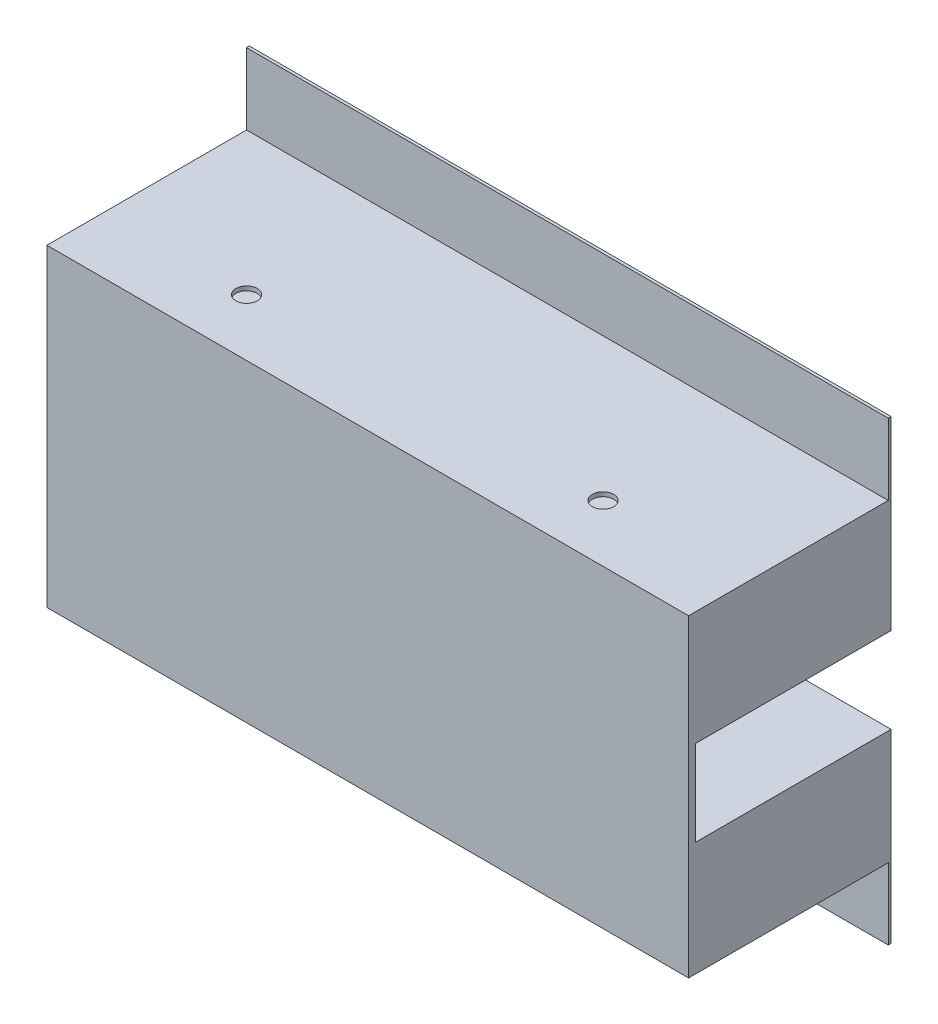
from build123d import *

# Parameters (mm, degrees)
SKETCH_1_W          = 450
SKETCH_1_H          = 220
EXTRUDE_1_DEPTH     = 140
SKETCH_2_W          = 450
SKETCH_2_H          = 320
EXTRUDE_2_DEPTH     = 2
SKETCH_3_W          = 444
SKETCH_3_H          = 214
CUT_EXTRUDE_1_DEPTH = 139
SKETCH_4_W          = 444
SKETCH_4_H          = 4
EXTRUDE_3_DEPTH     = 139
SKETCH_5_W          = 60
SKETCH_5_H          = 4
EXTRUDE_4_DEPTH     = 30
SKETCH_6_W          = 137
SKETCH_6_H          = 60
CUT_EXTRUDE_2_DEPTH = 10
SKETCH_7_R          = 7.5
CUT_EXTRUDE_3_DEPTH = 70
SKETCH_8_W          = 2
SKETCH_8_H          = 60
EXTRUDE_5_DEPTH     = 139
SKETCH_9_W          = 30
SKETCH_9_H          = 60
CUT_EXTRUDE_4_DEPTH = 240
SKETCH_10_R         = 7.5
CUT_EXTRUDE_5_DEPTH = 220
SKETCH_11_R         = 7.5
CUT_EXTRUDE_6_DEPTH = 220


with BuildPart() as part:
    # 草图1 → 凸台-拉伸1 (new body)
    with BuildSketch(Plane.XY):
        Rectangle(SKETCH_1_W, SKETCH_1_H)
    extrude(amount=EXTRUDE_1_DEPTH)

    # 草图2 → 凸台-拉伸2 (add)
    with BuildSketch(Plane(origin=(0, 0, 0), x_dir=(-1, 0, 0), z_dir=(0, 0, -1))):
        Rectangle(SKETCH_2_W, SKETCH_2_H)
    extrude(amount=EXTRUDE_2_DEPTH)

    # 草图3 → 切除-拉伸1 (cut)
    with BuildSketch(Plane(origin=(0, 0, -2), x_dir=(-1, 0, 0), z_dir=(0, 0, -1))):
        Rectangle(SKETCH_3_W, SKETCH_3_H)
    extrude(amount=-CUT_EXTRUDE_1_DEPTH, mode=Mode.SUBTRACT)

    # 草图4 → 凸台-拉伸3 (add)
    with BuildSketch(Plane(origin=(0, 0, 137), x_dir=(-1, 0, 0), z_dir=(0, 0, -1))):
        with Locations((0, -32)):
            Rectangle(SKETCH_4_W, SKETCH_4_H)
        with Locations((0, 32)):
            Rectangle(SKETCH_4_W, SKETCH_4_H)
    extrude(amount=EXTRUDE_3_DEPTH)

    # 草图5 → 凸台-拉伸4 (add)
    with BuildSketch(Plane(origin=(0, 0, -2), x_dir=(-1, 0, 0), z_dir=(0, 0, -1))):
        with Locations((-125, 32)):
            Rectangle(SKETCH_5_W, SKETCH_5_H)
        with Locations((-125, -32)):
            Rectangle(SKETCH_5_W, SKETCH_5_H)
    extrude(amount=EXTRUDE_4_DEPTH)

    # 草图6 → 切除-拉伸2 (cut)
    with BuildSketch(Plane(origin=(225, 0, 0), x_dir=(0, 0, -1), z_dir=(1, 0, 0))):
        with Locations((-66.5, 0)):
            Rectangle(SKETCH_6_W, SKETCH_6_H)
    extrude(amount=-CUT_EXTRUDE_2_DEPTH, mode=Mode.SUBTRACT)

    # 草图7 → 切除-拉伸3 (cut)
    with BuildSketch(Plane.XZ.offset(34)):
        with Locations(Location((125, -2, 0), (0, 0, 270))):
            Circle(SKETCH_7_R)
    extrude(amount=-CUT_EXTRUDE_3_DEPTH, mode=Mode.SUBTRACT)

    # 草图8 → 凸台-拉伸5 (add)
    with BuildSketch(Plane(origin=(0, 0, 137), x_dir=(-1, 0, 0), z_dir=(0, 0, -1))):
        with Locations((12, 0)):
            Rectangle(SKETCH_8_W, SKETCH_8_H)
    extrude(amount=EXTRUDE_5_DEPTH)

    # 草图9 → 切除-拉伸4 (cut)
    with BuildSketch(Plane.ZY.offset(225)):
        with Locations((13, 0)):
            Rectangle(SKETCH_9_W, SKETCH_9_H)
    extrude(amount=-CUT_EXTRUDE_4_DEPTH, mode=Mode.SUBTRACT)

    # 草图10 → 切除-拉伸5 (cut)
    with BuildSketch(Plane.XZ.offset(110)):
        with Locations(Location((125, 100, 0), (0, 0, 90))):
            Circle(SKETCH_10_R)
    extrude(amount=-CUT_EXTRUDE_5_DEPTH, mode=Mode.SUBTRACT)

    # 草图11 → 切除-拉伸6 (cut)
    with BuildSketch(Plane.XZ.offset(110)):
        with Locations(Location((-125, 100, 0), (0, 0, 90))):
            Circle(SKETCH_11_R)
    extrude(amount=-CUT_EXTRUDE_6_DEPTH, mode=Mode.SUBTRACT)


solid = part.part
